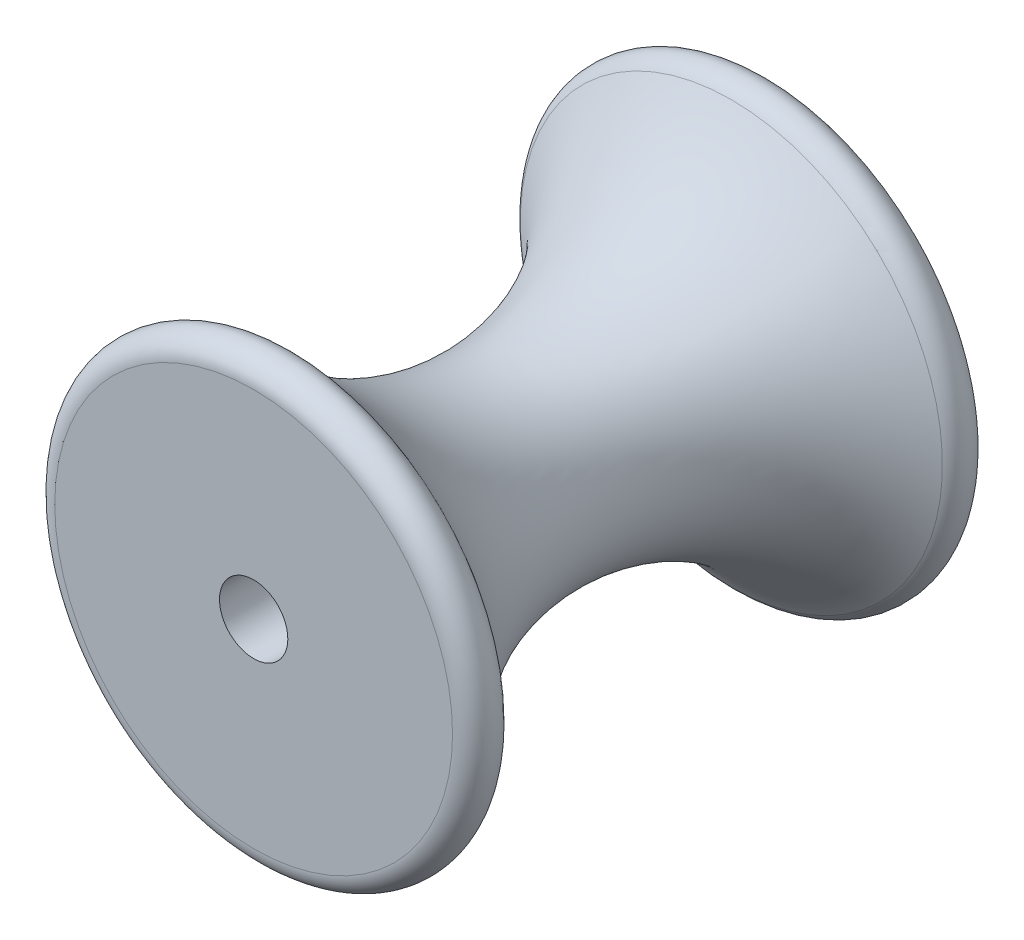
from build123d import *

# Parameters (mm, degrees)
FILLET1_R = 1


with BuildPart() as part:
    # Sketch1 → Revolve1 (revolve)
    with BuildSketch(Plane(origin=(0, 0, 0), x_dir=(0, 0, -1), z_dir=(1, 0, 0))):
        with BuildLine():
            Line((12.1, 1.6), (12.1, 13.863122572))
            ThreePointArc((12.1, 13.863122572), (0, 4.5), (-12.1, 13.863122572))
            Line((-12.1, 13.863122572), (-12.1, 1.6))
            Line((-12.1, 1.6), (12.1, 1.6))
        make_face()
    revolve(axis=Axis((0, 0, -12.5), (0, 0, 1)))

    # Fillet1
    fillet1_edges = [part.edges().sort_by_distance(p)[0] for p in [
        (0, -13.863122572, 12.1),
        (0, -13.863122572, -12.1),
    ]]
    fillet(fillet1_edges, radius=FILLET1_R)


solid = part.part
